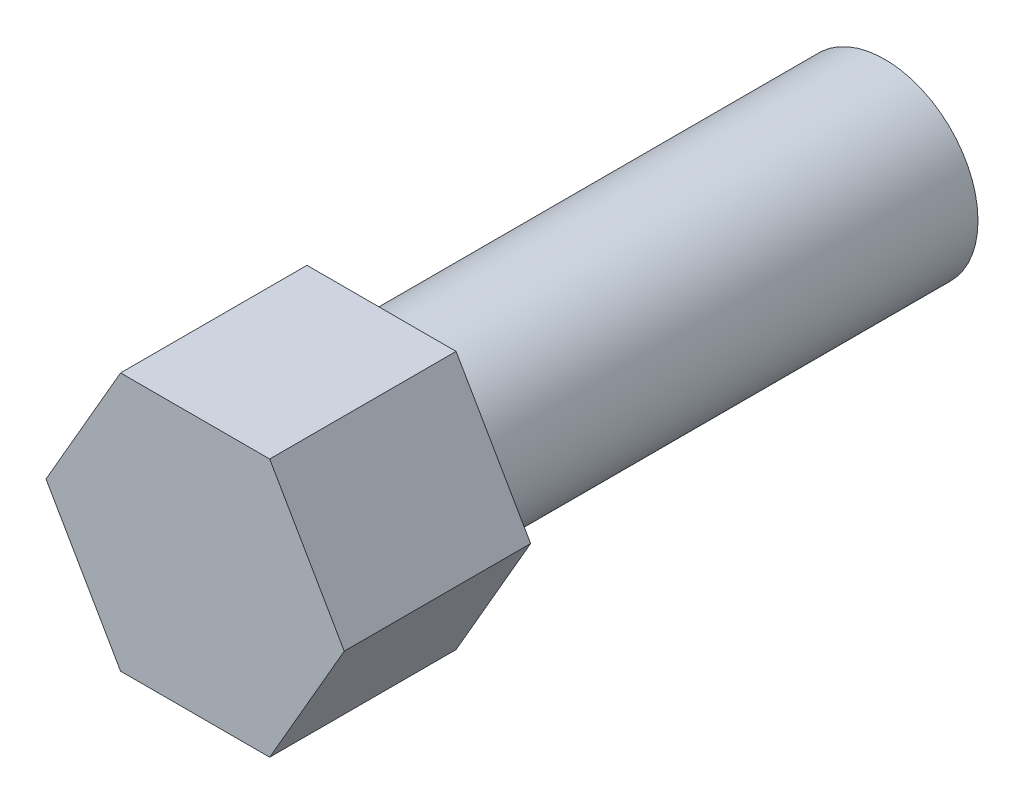
from build123d import *

# Parameters (mm, degrees)
EXTRUDE_1_DEPTH     = 10
SKETCH_3_R          = 4.5
SKETCH_3_R_2        = 2.5
EXTRUDE_2_DEPTH     = 120
SKETCH_4_R          = 1.5
CUT_EXTRUDE_1_DEPTH = 20
SKETCH_5_R          = 5
SKETCH_5_R_2        = 4.5
EXTRUDE_3_DEPTH     = 45
CUT_EXTRUDE_START   = -75
SKETCH_6_R          = 4.5
CUT_EXTRUDE_2_DEPTH = 75
CUT_EXTRUDE_START_2 = -18
SKETCH_7_R          = 5
CUT_EXTRUDE_3_DEPTH = 18


with BuildPart() as part:
    # 草图1 → 凸台-拉伸1 (new body)
    with BuildSketch(Plane.XY):
        Polygon((8, 0), (4, 6.92820323), (-4, 6.92820323), (-8, 0), (-4, -6.92820323), (4, -6.92820323), align=None)
    extrude(amount=EXTRUDE_1_DEPTH)

    # 草图3 → 凸台-拉伸2 (add)
    with BuildSketch(Plane(origin=(0, 0, 0), x_dir=(-1, 0, 0), z_dir=(0, 0, -1))):
        with Locations(Location((0, 0, 0), (0, 0, 180))):
            Circle(SKETCH_3_R)
        Circle(SKETCH_3_R_2, mode=Mode.SUBTRACT)
    extrude(amount=EXTRUDE_2_DEPTH)

    # 草图4 → 切除-拉伸1 (cut)
    with BuildSketch(Plane(origin=(0, 0, 0), x_dir=(1, 0, 0), z_dir=(0, 1, 0))):
        with Locations(Location((0, 110, 0), (0, 0, 270))):
            Circle(SKETCH_4_R)
    extrude(amount=-CUT_EXTRUDE_1_DEPTH, mode=Mode.SUBTRACT)

    # 草图5 → 凸台-拉伸3 (add)
    with BuildSketch(Plane(origin=(0, 0, 0), x_dir=(-1, 0, 0), z_dir=(0, 0, -1))):
        with Locations(Location((0, 0, 0), (0, 0, 180))):
            Circle(SKETCH_5_R)
        Circle(SKETCH_5_R_2, mode=Mode.SUBTRACT)
    extrude(amount=EXTRUDE_3_DEPTH)

    # 草图6 → 切除-拉伸2 (cut)
    with BuildSketch(Plane(origin=(0, 0, -120), x_dir=(-1, 0, 0), z_dir=(0, 0, -1)).offset(CUT_EXTRUDE_START)):
        Circle(SKETCH_6_R)
    extrude(amount=CUT_EXTRUDE_2_DEPTH, mode=Mode.SUBTRACT)

    # 草图7 → 切除-拉伸3 (cut)
    with BuildSketch(Plane(origin=(0, 0, -45), x_dir=(-1, 0, 0), z_dir=(0, 0, -1)).offset(CUT_EXTRUDE_START_2)):
        with Locations(Location((0, 0, 0), (0, 0, 180))):
            Circle(SKETCH_7_R)
    extrude(amount=CUT_EXTRUDE_3_DEPTH, mode=Mode.SUBTRACT)


solid = part.part
